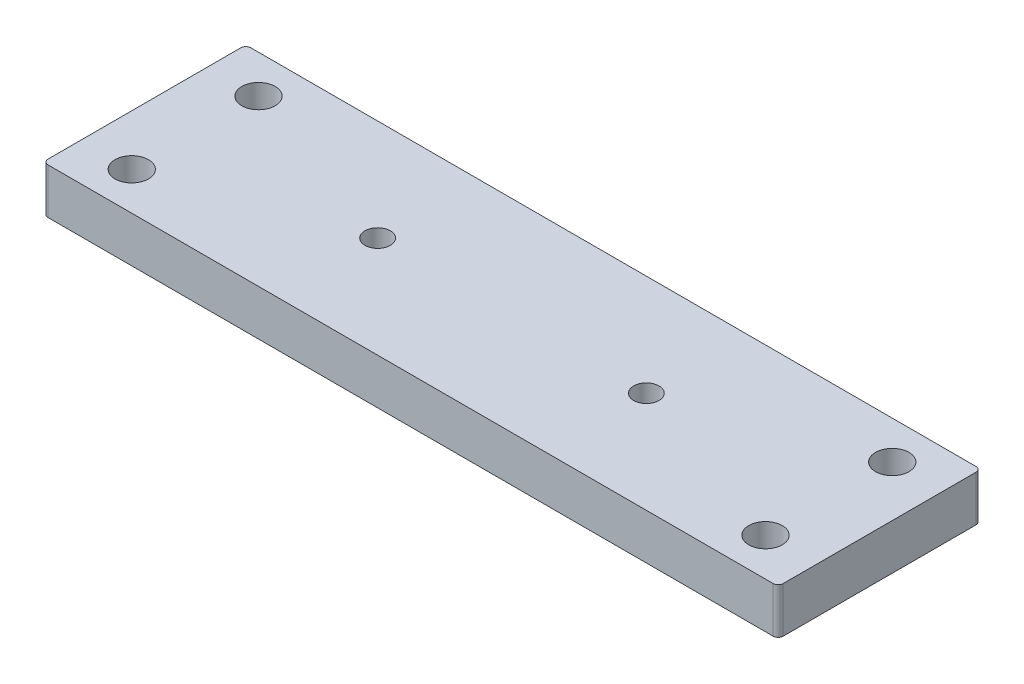
from build123d import *

# Parameters (mm, degrees)
SKETCH1_W           = 145
SKETCH1_H           = 40
SKETCH1_R           = 2.5
SKETCH1_R_2         = 3.3
BOSS_EXTRUDE1_DEPTH = 9
FILLET1_R           = 1


with BuildPart() as part:
    # Sketch1 → Boss-Extrude1 (new body)
    with BuildSketch(Plane(origin=(0, 0, 0), x_dir=(1, 0, 0), z_dir=(0, 1, 0))):
        Rectangle(SKETCH1_W, SKETCH1_H)
        with Locations(Location((26.5, 0, 0), (0, 0, 270))):
            Circle(SKETCH1_R, mode=Mode.SUBTRACT)
        with Locations(Location((62.5, -12.5, 0), (0, 0, 270))):
            Circle(SKETCH1_R_2, mode=Mode.SUBTRACT)
        with Locations(Location((62.5, 12.5, 0), (0, 0, 90))):
            Circle(SKETCH1_R_2, mode=Mode.SUBTRACT)
        with Locations(Location((-26.5, 0, 0), (0, 0, 90))):
            Circle(SKETCH1_R, mode=Mode.SUBTRACT)
        with Locations(Location((-62.5, 12.5, 0), (0, 0, 90))):
            Circle(SKETCH1_R_2, mode=Mode.SUBTRACT)
        with Locations(Location((-62.5, -12.5, 0), (0, 0, 270))):
            Circle(SKETCH1_R_2, mode=Mode.SUBTRACT)
    extrude(amount=BOSS_EXTRUDE1_DEPTH)

    # Fillet1
    fillet1_edges = [part.edges().sort_by_distance(p)[0] for p in [
        (72.5, 4.5, 20),
        (-72.5, 4.5, 20),
        (-72.5, 4.5, -20),
        (72.5, 4.5, -20),
    ]]
    fillet(fillet1_edges, radius=FILLET1_R)


solid = part.part
